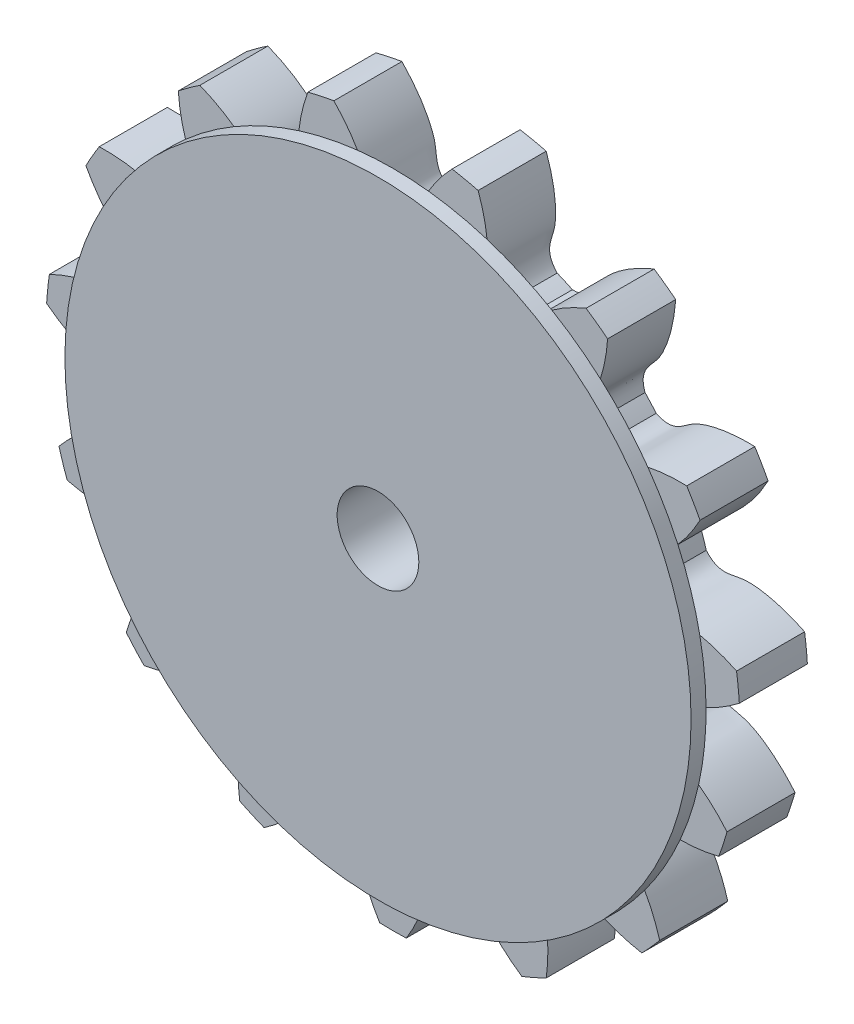
from build123d import *

# Parameters (mm, degrees)
SKETCH_1_R               = 5.1
EXTRUDE_1_DEPTH          = 1
CUT_EXTRUDE_1_DEPTH      = 8.281483365
PATTERN_CIRCULAR_1_COUNT = 15
SKETCH_5_R               = 4.6
EXTRUDE_2_DEPTH          = 0.22
CUT_EXTRUDE_2_DEPTH      = 8.273639992
CUT_EXTRUDE_2_DEPTH_BACK = 8.273639992
SKETCH_4_R               = 0.6


with BuildPart() as part:
    # 草图1 → 凸台-拉伸1 (new body)
    with BuildSketch(Plane.XY):
        Circle(SKETCH_1_R)
    extrude(amount=EXTRUDE_1_DEPTH)

    # 草图2 → 切除-拉伸1 (cut, through all)
    with BuildSketch(Plane.XY):
        with BuildLine():
            ThreePointArc((0.122571025, 3.747996311), (0, 3.75), (-0.122571025, 3.747996311))
            add(Edge.make_bspline(
                [(-0.122571025, 3.747996311), (-0.394327835, 3.860646137), (-0.34326788, 4.071797654), (-0.390756292, 4.265102259), (-0.394459907, 4.278994978), (-0.398909308, 4.294436294), (-0.404166143, 4.311401583), (-0.410293441, 4.329863985), (-0.417352818, 4.349794859), (-0.425405282, 4.37116366), (-0.434510915, 4.39393801), (-0.44472891, 4.418083704), (-0.456117495, 4.443564736), (-0.46873389, 4.470343326), (-0.48263426, 4.498379945), (-0.497873671, 4.527633342), (-0.514506036, 4.558060574), (-0.532584078, 4.589617033), (-0.552159279, 4.622256479), (-0.573281838, 4.655931072), (-0.59600063, 4.690591403), (-0.620363158, 4.726186532), (-0.646415518, 4.762664018), (-0.674202352, 4.79996996), (-0.703766814, 4.83804903), (-0.735150526, 4.876844517), (-0.768393543, 4.916298359), (-0.803534314, 4.956351191), (-0.840609648, 4.996942378), (-0.879654677, 5.038010065), (-0.920702824, 5.079491215), (-0.963785767, 5.121321654), (-1.008933411, 5.163436116), (-1.056173853, 5.205768288), (-1.105533357, 5.248250859), (-1.15703632, 5.290815561), (-1.210705249, 5.333393223), (-1.266560733, 5.375913818), (-1.324621418, 5.41830651), (-1.384903983, 5.460499705), (-1.447423119, 5.502421102), (-1.512191504, 5.543997745), (-1.579219786, 5.585156072), (-1.648516565, 5.625821968), (-1.720088365, 5.665920822), (-1.819551397, 5.719061222), (-1.896091148, 5.75702038), (-1.948103033, 5.781556924)],
                knots=[0, 0, 0, 0, 0.202473101, 0.206978902, 0.212085478, 0.217792827, 0.224100949, 0.231009845, 0.238519514, 0.246629958, 0.255341174, 0.264653164, 0.274565928, 0.285079465, 0.296193776, 0.307908861, 0.320224719, 0.33314135, 0.346658755, 0.360776934, 0.375495886, 0.390815612, 0.406736111, 0.423257384, 0.440379431, 0.458102251, 0.476425844, 0.495350211, 0.514875352, 0.535001266, 0.555727954, 0.577055415, 0.59898365, 0.621512658, 0.64464244, 0.668372996, 0.692704325, 0.717636428, 0.743169304, 0.769302954, 0.796037377, 0.823372574, 0.851308544, 0.879845288, 0.908982806, 0.938721097, 1, 1, 1, 1], degree=3))
            ThreePointArc((-1.948103033, 5.781556924), (0, 6.100943033), (1.948103033, 5.781556924))
            add(Edge.make_bspline(
                [(0.122571025, 3.747996311), (0.394327835, 3.860646137), (0.34326788, 4.071797654), (0.390756292, 4.265102259), (0.394459907, 4.278994978), (0.398909308, 4.294436294), (0.404166143, 4.311401583), (0.410293441, 4.329863985), (0.417352818, 4.349794859), (0.425405282, 4.37116366), (0.434510915, 4.39393801), (0.44472891, 4.418083704), (0.456117495, 4.443564736), (0.46873389, 4.470343326), (0.48263426, 4.498379945), (0.497873671, 4.527633342), (0.514506036, 4.558060574), (0.532584078, 4.589617033), (0.552159279, 4.622256479), (0.573281838, 4.655931072), (0.59600063, 4.690591403), (0.620363158, 4.726186532), (0.646415518, 4.762664018), (0.674202352, 4.79996996), (0.703766814, 4.83804903), (0.735150526, 4.876844517), (0.768393543, 4.916298359), (0.803534314, 4.956351191), (0.840609648, 4.996942378), (0.879654677, 5.038010065), (0.920702824, 5.079491215), (0.963785767, 5.121321654), (1.008933411, 5.163436116), (1.056173853, 5.205768288), (1.105533357, 5.248250859), (1.15703632, 5.290815561), (1.210705249, 5.333393223), (1.266560733, 5.375913818), (1.324621418, 5.41830651), (1.384903983, 5.460499705), (1.447423119, 5.502421102), (1.512191504, 5.543997745), (1.579219786, 5.585156072), (1.648516565, 5.625821968), (1.720088365, 5.665920822), (1.819551397, 5.719061222), (1.896091148, 5.75702038), (1.948103033, 5.781556924)],
                knots=[0, 0, 0, 0, 0.202473101, 0.206978902, 0.212085478, 0.217792827, 0.224100949, 0.231009845, 0.238519514, 0.246629958, 0.255341174, 0.264653164, 0.274565928, 0.285079465, 0.296193776, 0.307908861, 0.320224719, 0.33314135, 0.346658755, 0.360776934, 0.375495886, 0.390815612, 0.406736111, 0.423257384, 0.440379431, 0.458102251, 0.476425844, 0.495350211, 0.514875352, 0.535001266, 0.555727954, 0.577055415, 0.59898365, 0.621512658, 0.64464244, 0.668372996, 0.692704325, 0.717636428, 0.743169304, 0.769302954, 0.796037377, 0.823372574, 0.851308544, 0.879845288, 0.908982806, 0.938721097, 1, 1, 1, 1], degree=3))
        make_face()
    cut_extrude_1 = extrude(amount=CUT_EXTRUDE_1_DEPTH, mode=Mode.SUBTRACT)

    # 阵列(圆周)1: 切除-拉伸1 ×15 about axis
    pattern_circular_1_axis = Axis((0, 0, -1.5), (0, 0, 1))
    for i in range(1, PATTERN_CIRCULAR_1_COUNT):
        add(cut_extrude_1.rotate(pattern_circular_1_axis, i * 360 / PATTERN_CIRCULAR_1_COUNT), mode=Mode.SUBTRACT)

    # 草图5 → 凸台-拉伸2 (add)
    with BuildSketch(Plane.XY.offset(1)):
        Circle(SKETCH_5_R)
    extrude(amount=EXTRUDE_2_DEPTH)

    # 草图4 → 切除-拉伸2 (cut, two sides: drawn at the far end of the back side and taken through both)
    with BuildSketch(Plane.XY.offset(1).offset(-CUT_EXTRUDE_2_DEPTH_BACK)):
        Circle(SKETCH_4_R)
    extrude(amount=CUT_EXTRUDE_2_DEPTH + CUT_EXTRUDE_2_DEPTH_BACK, mode=Mode.SUBTRACT)


solid = part.part
